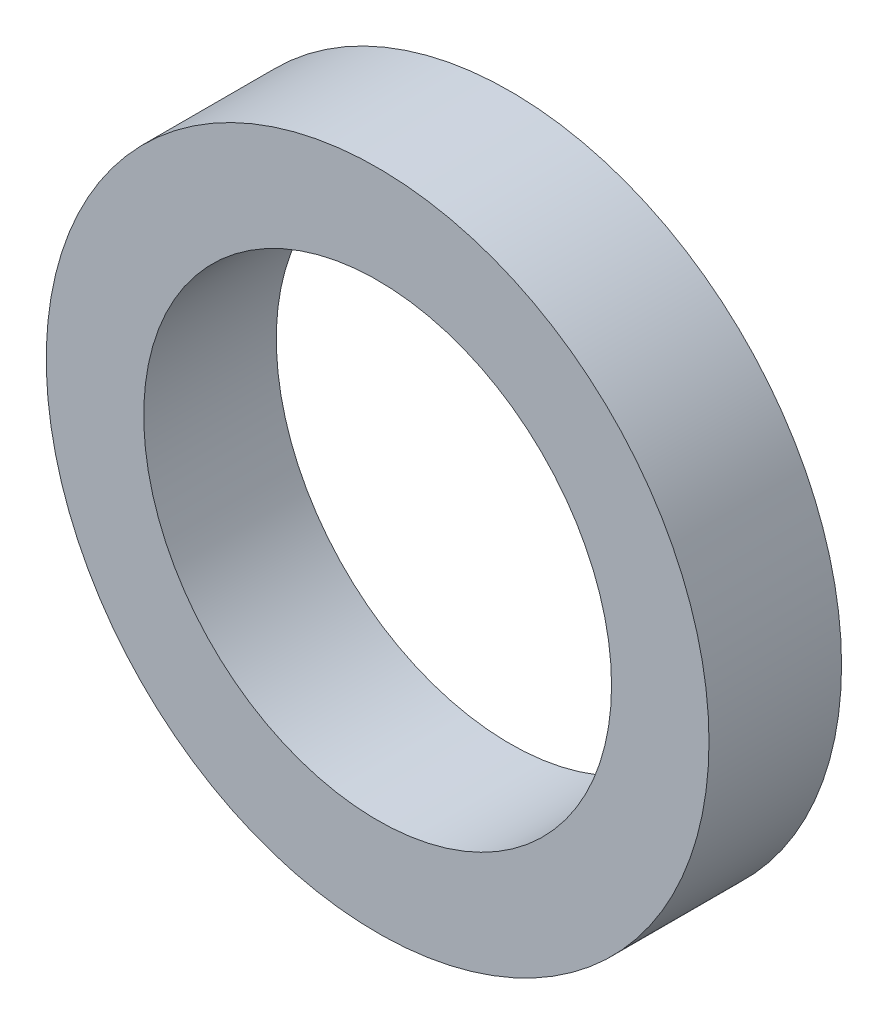
from build123d import *

# Parameters (mm, degrees)
SKETCH_1_R      = 42.5
SKETCH_1_R_2    = 30
EXTRUDE_1_DEPTH = 17


with BuildPart() as part:
    # 草图1 → 凸台-拉伸1 (new body)
    with BuildSketch(Plane.XY):
        Circle(SKETCH_1_R)
        Circle(SKETCH_1_R_2, mode=Mode.SUBTRACT)
    extrude(amount=EXTRUDE_1_DEPTH)


solid = part.part
